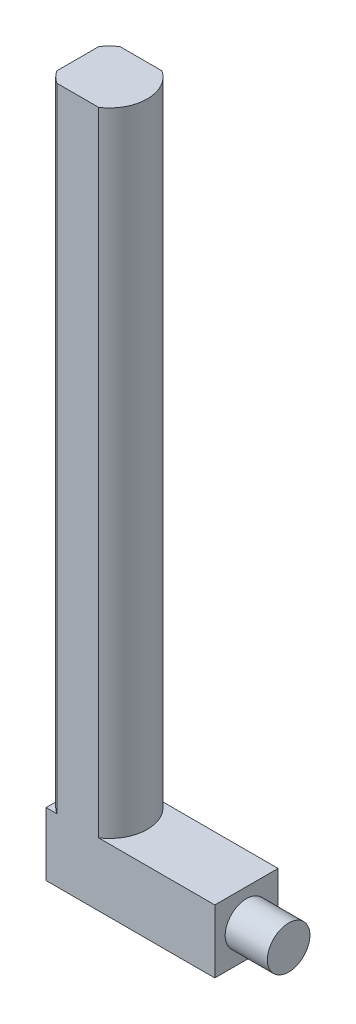
from build123d import *

# Parameters (mm, degrees)
SKETCH1_W           = 101.6
SKETCH1_H           = 38.1
BOSS_EXTRUDE1_DEPTH = 38.1
BOSS_EXTRUDE2_DEPTH = 25.4
BOSS_EXTRUDE3_DEPTH = 381
SCALE1_SCALE        = 1.5


with BuildPart() as part:
    # Sketch1 → Boss-Extrude1 (new body)
    with BuildSketch(Plane(origin=(0, 0, 0), x_dir=(1, 0, 0), z_dir=(0, 1, 0))):
        with Locations((50.8, 19.05)):
            Rectangle(SKETCH1_W, SKETCH1_H)
    extrude(amount=BOSS_EXTRUDE1_DEPTH)

    # Sketch2 → Boss-Extrude2 (add)
    with BuildSketch(Plane(origin=(101.6, 0, 0), x_dir=(0, 0, -1), z_dir=(1, 0, 0))):
        with BuildLine():
            ThreePointArc((28.108587284, 28.108587284), (19.05, 31.860776993), (9.991412716, 28.108587284))
            Line((9.991412716, 28.108587284), (19.05, 19.05))
            Line((19.05, 19.05), (28.108587284, 28.108587284))
        make_face()
        with BuildLine():
            Line((19.05, 19.05), (9.991412716, 28.108587284))
            ThreePointArc((9.991412716, 28.108587284), (6.239223007, 19.05), (9.991412716, 9.991412716))
            Line((9.991412716, 9.991412716), (19.05, 19.05))
        make_face()
        with BuildLine():
            Line((28.108587284, 28.108587284), (19.05, 19.05))
            Line((19.05, 19.05), (28.108587284, 9.991412716))
            ThreePointArc((28.108587284, 9.991412716), (30.885614659, 14.147527889), (31.860776993, 19.05))
            ThreePointArc((31.860776993, 19.05), (30.885614659, 23.952472111), (28.108587284, 28.108587284))
        make_face()
        with BuildLine():
            Line((28.108587284, 9.991412716), (19.05, 19.05))
            Line((19.05, 19.05), (9.991412716, 9.991412716))
            ThreePointArc((9.991412716, 9.991412716), (19.05, 6.239223007), (28.108587284, 9.991412716))
        make_face()
    extrude(amount=BOSS_EXTRUDE2_DEPTH)

    # Sketch3 → Boss-Extrude3 (add)
    with BuildSketch(Plane(origin=(0, 38.1, 0), x_dir=(1, 0, 0), z_dir=(0, 1, 0))):
        with BuildLine():
            Line((33.415123016, 4.684876984), (19.05, 19.05))
            Line((19.05, 19.05), (4.684876984, 4.684876984))
            ThreePointArc((4.684876984, 4.684876984), (8.08545393, 1.947595257), (11.992307848, 0))
            Line((11.992307848, 0), (26.107692152, 0))
            ThreePointArc((26.107692152, 0), (30.01454607, 1.947595257), (33.415123016, 4.684876984))
        make_face()
        with BuildLine():
            Line((33.415123016, 33.415123016), (19.05, 19.05))
            Line((19.05, 19.05), (33.415123016, 4.684876984))
            ThreePointArc((33.415123016, 4.684876984), (37.818937718, 11.275651446), (39.365351794, 19.05))
            ThreePointArc((39.365351794, 19.05), (37.818937718, 26.824348554), (33.415123016, 33.415123016))
        make_face()
        with BuildLine():
            ThreePointArc((11.992307848, 38.1), (8.08545393, 36.152404743), (4.684876984, 33.415123016))
            Line((4.684876984, 33.415123016), (19.05, 19.05))
            Line((19.05, 19.05), (33.415123016, 33.415123016))
            ThreePointArc((33.415123016, 33.415123016), (30.01454607, 36.152404743), (26.107692152, 38.1))
            Line((26.107692152, 38.1), (11.992307848, 38.1))
        make_face()
        with BuildLine():
            Line((19.05, 19.05), (4.684876984, 33.415123016))
            ThreePointArc((4.684876984, 33.415123016), (1.947595257, 30.01454607), (0, 26.107692152))
            Line((0, 26.107692152), (0, 11.992307848))
            ThreePointArc((0, 11.992307848), (1.947595257, 8.08545393), (4.684876984, 4.684876984))
            Line((4.684876984, 4.684876984), (19.05, 19.05))
        make_face()
        with BuildLine():
            ThreePointArc((35.21117424, 35.21117424), (33.516839784, 36.74400046), (31.677929586, 38.1))
            Line((31.677929586, 38.1), (26.107692152, 38.1))
            ThreePointArc((26.107692152, 38.1), (30.01454607, 36.152404743), (33.415123016, 33.415123016))
            Line((33.415123016, 33.415123016), (35.21117424, 35.21117424))
        make_face()
        with BuildLine():
            ThreePointArc((41.905351794, 19.05), (40.165591731, 27.796364472), (35.21117424, 35.21117424))
            Line((35.21117424, 35.21117424), (33.415123016, 33.415123016))
            ThreePointArc((33.415123016, 33.415123016), (37.818937718, 26.824348554), (39.365351794, 19.05))
            ThreePointArc((39.365351794, 19.05), (37.818937718, 11.275651446), (33.415123016, 4.684876984))
            Line((33.415123016, 4.684876984), (35.21117424, 2.88882576))
            ThreePointArc((35.21117424, 2.88882576), (40.165591731, 10.303635528), (41.905351794, 19.05))
        make_face()
        with BuildLine():
            Line((35.21117424, 2.88882576), (33.415123016, 4.684876984))
            ThreePointArc((33.415123016, 4.684876984), (30.01454607, 1.947595257), (26.107692152, 0))
            Line((26.107692152, 0), (31.677929586, 0))
            ThreePointArc((31.677929586, 0), (33.516839784, 1.35599954), (35.21117424, 2.88882576))
        make_face()
        with BuildLine():
            Line((4.684876984, 4.684876984), (2.88882576, 2.88882576))
            ThreePointArc((2.88882576, 2.88882576), (4.583160216, 1.35599954), (6.422070414, 0))
            Line((6.422070414, 0), (11.992307848, 0))
            ThreePointArc((11.992307848, 0), (8.08545393, 1.947595257), (4.684876984, 4.684876984))
        make_face()
        with BuildLine():
            Line((0, 11.992307848), (0, 6.422070414))
            ThreePointArc((0, 6.422070414), (1.35599954, 4.583160216), (2.88882576, 2.88882576))
            Line((2.88882576, 2.88882576), (4.684876984, 4.684876984))
            ThreePointArc((4.684876984, 4.684876984), (1.947595257, 8.08545393), (0, 11.992307848))
        make_face()
        with BuildLine():
            ThreePointArc((6.422070414, 38.1), (4.583160216, 36.74400046), (2.88882576, 35.21117424))
            Line((2.88882576, 35.21117424), (4.684876984, 33.415123016))
            ThreePointArc((4.684876984, 33.415123016), (8.08545393, 36.152404743), (11.992307848, 38.1))
            Line((11.992307848, 38.1), (6.422070414, 38.1))
        make_face()
        with BuildLine():
            Line((4.684876984, 33.415123016), (2.88882576, 35.21117424))
            ThreePointArc((2.88882576, 35.21117424), (1.35599954, 33.516839784), (0, 31.677929586))
            Line((0, 31.677929586), (0, 26.107692152))
            ThreePointArc((0, 26.107692152), (1.947595257, 30.01454607), (4.684876984, 33.415123016))
        make_face()
    extrude(amount=BOSS_EXTRUDE3_DEPTH)


with BuildPart() as part_1:
    # Scale1: scaled about (28.106189099, 181.291595576, -19.05)
    add(part.part.scale(SCALE1_SCALE).moved(Location((-14.05309455, -90.645797788, 9.525))))


solid = part_1.part
